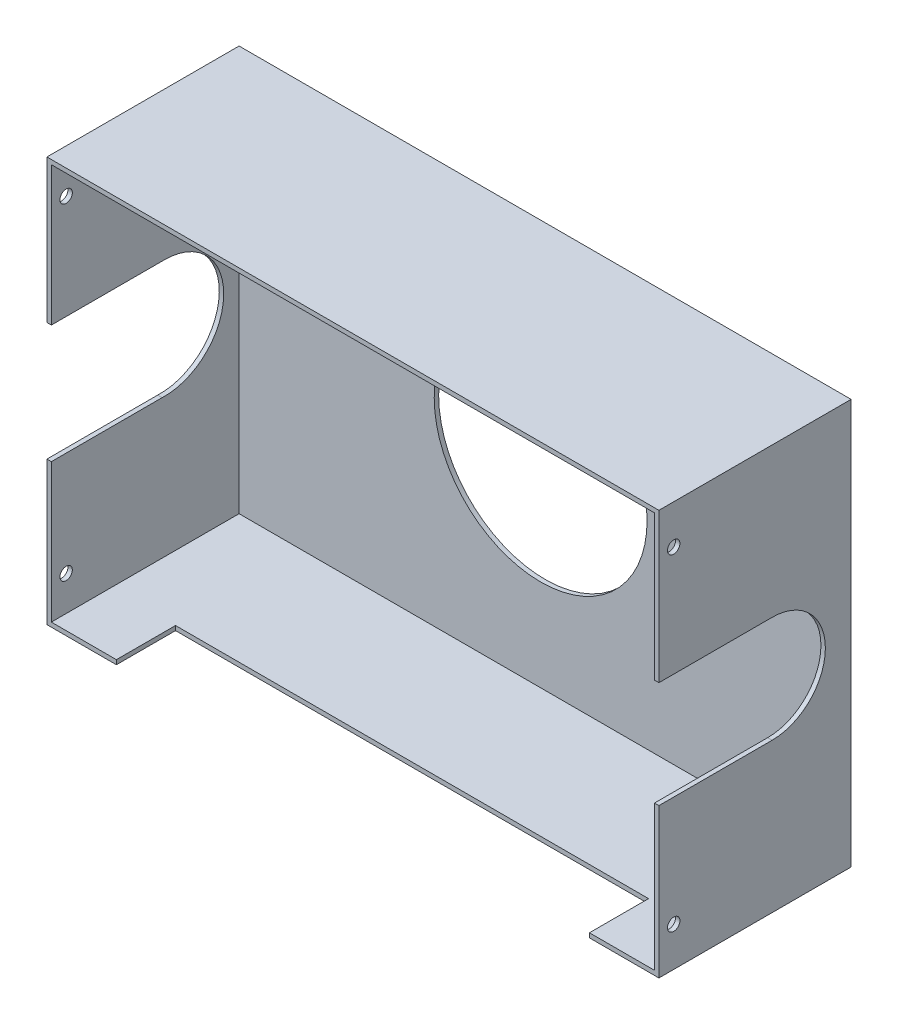
from build123d import *

# Parameters (mm, degrees)
SKETCH_1_W                      = 207
SKETCH_1_H                      = 137
EXTRUDE_1_DEPTH                 = 65
SHELL_1_T                       = -1.5
SKETCH_2_R                      = 36
CUT_EXTRUDE_1_DEPTH             = 80
CUT_EXTRUDE_2_REACH             = 229.522
CUT_EXTRUDE_3_REACH             = 229.522
CUT_EXTRUDE_3_DIRECTION_2_DEPTH = 228.52197696
HOLE_WIZARD_M5_3_D              = 4.2
CUT_EXTRUDE_4_REACH             = 185.593
SKETCH_6_W                      = 160
SKETCH_6_H                      = 20


with BuildPart() as part:
    # 草图1 → 凸台-拉伸1 (new body)
    with BuildSketch(Plane.XY):
        Rectangle(SKETCH_1_W, SKETCH_1_H)
    extrude(amount=EXTRUDE_1_DEPTH)

    # 抽壳1
    shell_1_openings = [part.faces().sort_by_distance(p)[0] for p in [
        (0, 0, 65),
    ]]
    offset(amount=SHELL_1_T, openings=shell_1_openings, kind=Kind.INTERSECTION)

    # 草图2 → 切除-拉伸1 (cut)
    with BuildSketch(Plane(origin=(0, 0, 0), x_dir=(-1, 0, 0), z_dir=(0, 0, -1))):
        Circle(SKETCH_2_R)
    extrude(amount=-CUT_EXTRUDE_1_DEPTH, mode=Mode.SUBTRACT)

    # 草图4 → 切除-拉伸2 (cut, up to next)
    with BuildSketch(Plane(origin=(103.5, 0, 0), x_dir=(0, 0, -1), z_dir=(1, 0, 0)), mode=Mode.PRIVATE) as cut_extrude_2_sk1:
        with BuildLine():
            Line((-26.7, 18), (-65, 18))
            Line((-65, 18), (-65, -18))
            Line((-65, -18), (-26.7, -18))
            ThreePointArc((-26.7, -18), (-8.7, 0), (-26.7, 18))
        make_face()
    cut_extrude_2_tool1 = extrude(cut_extrude_2_sk1.sketch, amount=-CUT_EXTRUDE_2_REACH, mode=Mode.PRIVATE) & part.part
    add(cut_extrude_2_tool1.solids().sort_by_distance((103.5, 0, 38.627513))[0], mode=Mode.SUBTRACT)

    # 草图5 → 切除-拉伸3 (cut, up to next)
    with BuildSketch(Plane.ZY.offset(103.5), mode=Mode.PRIVATE) as cut_extrude_3_sk1:
        with BuildLine():
            Line((26.7, 20), (65, 20))
            Line((65, 20), (65, -20))
            Line((65, -20), (27.541433506, -19.982291902))
            ThreePointArc((27.541433506, -19.982291902), (6.704427515, -0.42080991), (26.7, 20))
        make_face()
    cut_extrude_3_tool1 = extrude(cut_extrude_3_sk1.sketch, amount=-CUT_EXTRUDE_3_REACH, mode=Mode.PRIVATE) & part.part
    add(cut_extrude_3_tool1.solids().sort_by_distance((-103.5, 0.003116, 37.811224))[0], mode=Mode.SUBTRACT)

    # 草图5 → 切除-拉伸3 direction 2 (cut)
    with BuildSketch(Plane.ZY.offset(103.5)):
        with BuildLine():
            Line((26.7, 20), (65, 20))
            Line((65, 20), (65, -20))
            Line((65, -20), (27.541433506, -19.982291902))
            ThreePointArc((27.541433506, -19.982291902), (6.704427515, -0.42080991), (26.7, 20))
        make_face()
    extrude(amount=CUT_EXTRUDE_3_DIRECTION_2_DEPTH, mode=Mode.SUBTRACT)

    # M5 螺纹槽口的螺纹槽口钻头3 (through all)
    with Locations(Plane.ZY.offset(103.5)):
        with Locations((60, 55.25), (60, -55.25)):
            Hole(HOLE_WIZARD_M5_3_D / 2)

    # 草图6 → 切除-拉伸4 (cut, up to next)
    with BuildSketch(Plane.XZ.offset(68.5), mode=Mode.PRIVATE) as cut_extrude_4_sk1:
        with Locations((0, 55)):
            Rectangle(SKETCH_6_W, SKETCH_6_H)
    cut_extrude_4_tool1 = extrude(cut_extrude_4_sk1.sketch, amount=-CUT_EXTRUDE_4_REACH, mode=Mode.PRIVATE) & part.part
    add(cut_extrude_4_tool1.solids().sort_by_distance((0, -68.5, 55))[0], mode=Mode.SUBTRACT)


solid = part.part
